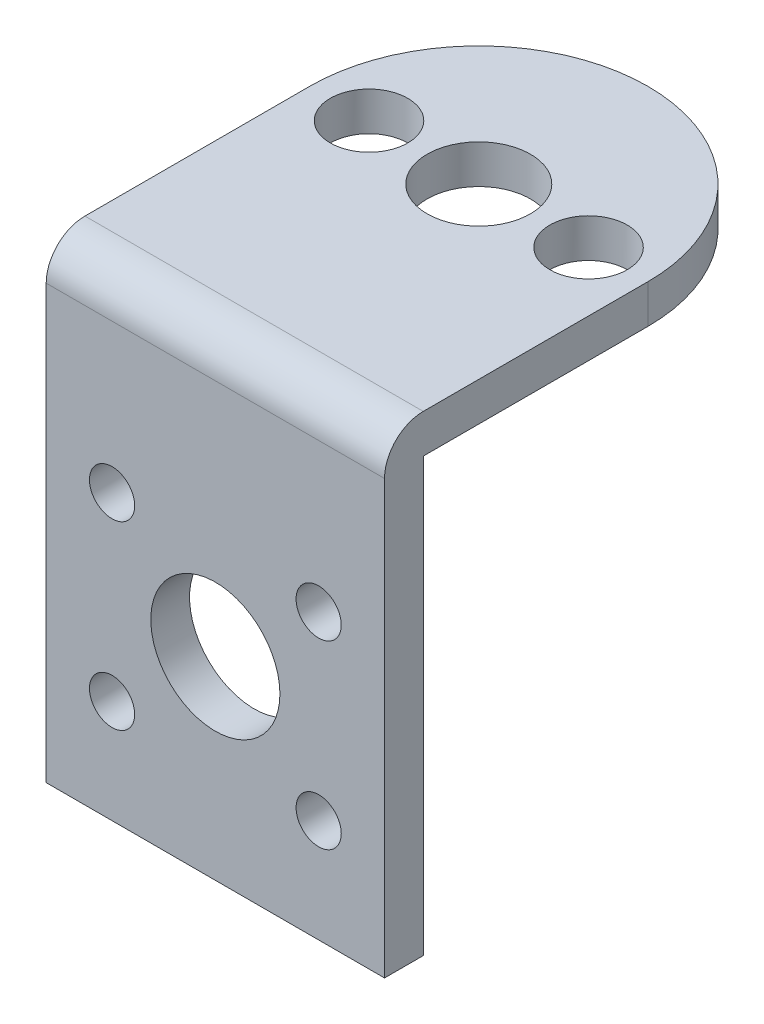
from build123d import *

# Parameters (mm, degrees)
SKETCH_3_R          = 4
EXTRUDE_1_DEPTH     = 3
SKETCH_4_W          = 26.2
SKETCH_4_H          = 33.5
SKETCH_4_R          = 5
SKETCH_4_R_2        = 1.75
EXTRUDE_2_DEPTH     = 3
FILLET_1_R          = 3
SKETCH_7_R          = 3
CUT_EXTRUDE_1_DEPTH = 52.245585176


with BuildPart() as part:
    # 草图3 → 凸台-拉伸1 (new body)
    with BuildSketch(Plane(origin=(0, 0, 0), x_dir=(1, 0, 0), z_dir=(0, 1, 0))):
        with BuildLine():
            Line((0, 0), (-13.1, 0))
            Line((-13.1, 0), (-13.1, 20.4))
            ThreePointArc((-13.1, 20.4), (0, 33.5), (13.1, 20.4))
            Line((13.1, 20.4), (13.1, 0))
            Line((13.1, 0), (0, 0))
        make_face()
        with Locations(Location((0, 20.4, 0), (0, 0, 270))):
            Circle(SKETCH_3_R, mode=Mode.SUBTRACT)
    extrude(amount=-EXTRUDE_1_DEPTH)

    # 草图4 → 凸台-拉伸2 (add)
    with BuildSketch(Plane.XY):
        with Locations((0, -19.75)):
            Rectangle(SKETCH_4_W, SKETCH_4_H)
        with Locations((0, -21.5)):
            Circle(SKETCH_4_R, mode=Mode.SUBTRACT)
        with Locations((8, -28.5)):
            Circle(SKETCH_4_R_2, mode=Mode.SUBTRACT)
        with Locations((8, -14.5)):
            Circle(SKETCH_4_R_2, mode=Mode.SUBTRACT)
        with Locations(Location((-8, -14.5, 0), (0, 0, 180))):
            Circle(SKETCH_4_R_2, mode=Mode.SUBTRACT)
        with Locations(Location((-8, -28.5, 0), (0, 0, 180))):
            Circle(SKETCH_4_R_2, mode=Mode.SUBTRACT)
    extrude(amount=-EXTRUDE_2_DEPTH)

    # 圆角1
    fillet_1_edges = [part.edges().sort_by_distance(p)[0] for p in [
        (0, 0, 0),
    ]]
    fillet(fillet_1_edges, radius=FILLET_1_R)

    # 草图7 → 切除-拉伸1 (cut, through all)
    with BuildSketch(Plane(origin=(0, 0, 0), x_dir=(1, 0, 0), z_dir=(0, 1, 0))):
        with Locations(Location((8.5, 20.4, 0), (0, 0, 270))):
            Circle(SKETCH_7_R)
    cut_extrude_1 = extrude(amount=-CUT_EXTRUDE_1_DEPTH, mode=Mode.SUBTRACT)

    # 镜向1: 切除-拉伸1 across plane
    add(cut_extrude_1.mirror(Plane(origin=(0, 0, 0), x_dir=(0, 0, 1), z_dir=(1, 0, 0))), mode=Mode.SUBTRACT)


solid = part.part
